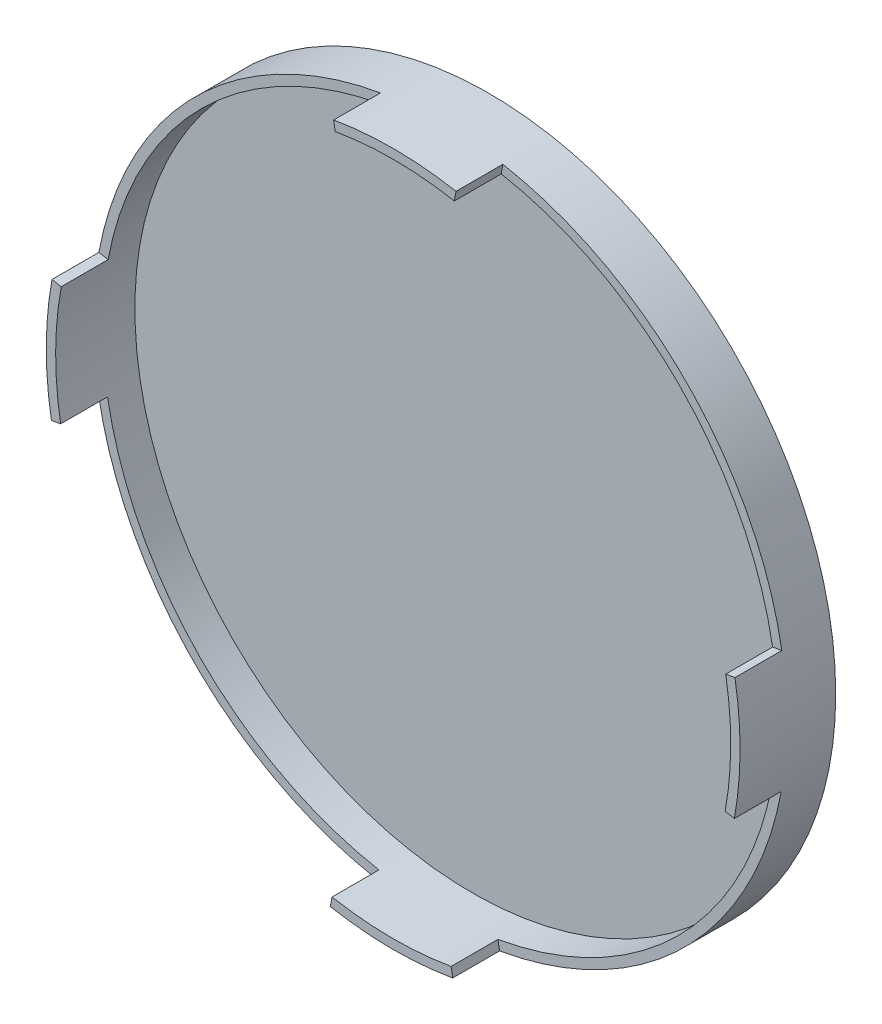
from build123d import *
from build123d.topology import SkipClean

# Parameters (mm, degrees)
SKETCH1_R           = 74
BOSS_EXTRUDE1_DEPTH = 3.5
SKETCH3_R           = 74
SKETCH3_R_2         = 72
BOSS_EXTRUDE2_DEPTH = 10.4
BOSS_EXTRUDE3_DEPTH = 10
CIRPATTERN1_COUNT   = 4
SKETCH2_R           = 16
SKETCH2_R_2         = 15
CUT_EXTRUDE1_DEPTH  = 1
SKETCH2_3_R         = 27
SKETCH2_3_R_2       = 26
CUT_EXTRUDE2_DEPTH  = 1
SKETCH2_4_R         = 38
SKETCH2_4_R_2       = 37
CUT_EXTRUDE3_DEPTH  = 1
SKETCH2_5_R         = 49
SKETCH2_5_R_2       = 48
CUT_EXTRUDE4_DEPTH  = 1
SKETCH2_6_R         = 60
SKETCH2_6_R_2       = 59
CUT_EXTRUDE5_DEPTH  = 1
FILLET1_R           = 0.5


with BuildPart() as part:
    # Sketch1 → Boss-Extrude1 (new body)
    with BuildSketch(Plane.XY):
        Circle(SKETCH1_R)
    extrude(amount=BOSS_EXTRUDE1_DEPTH)

    # Sketch3 → Boss-Extrude2 (add)
    with BuildSketch(Plane.XY):
        Circle(SKETCH3_R)
        Circle(SKETCH3_R_2, mode=Mode.SUBTRACT)
    extrude(amount=BOSS_EXTRUDE2_DEPTH)

    # Sketch5 → Boss-Extrude3 (add)
    with SkipClean():  # the faces are left unmerged after this step: merging them gives an invalid solid
        with BuildSketch(Plane.XY.offset(10.4)):
            with BuildLine():
                Line((-12.354120349, 70.932190932), (-12.697290359, 72.902529569))
                ThreePointArc((-12.697290359, 72.902529569), (0.361150189, 73.999118715), (13.408265197, 72.775122291))
                Line((13.408265197, 72.775122291), (13.045879651, 70.808227094))
                ThreePointArc((13.045879651, 70.808227094), (0.351389373, 71.999142533), (-12.354120349, 70.932190932))
            make_face()
        boss_extrude3 = extrude(amount=BOSS_EXTRUDE3_DEPTH)

    # CirPattern1: Boss-Extrude3 ×4 about axis
    with SkipClean():  # the faces are left unmerged after this step: merging them gives an invalid solid
        cirpattern1_axis = Axis((0, 0, 3.5), (0, 0, 1))
        for i in range(1, CIRPATTERN1_COUNT):
            add(boss_extrude3.rotate(cirpattern1_axis, i * 360 / CIRPATTERN1_COUNT))

    # Sketch2 → Cut-Extrude1 (cut)
    with SkipClean():  # the faces are left unmerged after this step: merging them gives an invalid solid
        with BuildSketch(Plane.XY):
            Circle(SKETCH2_R)
            Circle(SKETCH2_R_2, mode=Mode.SUBTRACT)
        extrude(amount=CUT_EXTRUDE1_DEPTH, mode=Mode.SUBTRACT)

    # Sketch2<3> → Cut-Extrude2 (cut)
    with SkipClean():  # the faces are left unmerged after this step: merging them gives an invalid solid
        with BuildSketch(Plane.XY):
            Circle(SKETCH2_3_R)
            Circle(SKETCH2_3_R_2, mode=Mode.SUBTRACT)
        extrude(amount=CUT_EXTRUDE2_DEPTH, mode=Mode.SUBTRACT)

    # Sketch2<4> → Cut-Extrude3 (cut)
    with SkipClean():  # the faces are left unmerged after this step: merging them gives an invalid solid
        with BuildSketch(Plane.XY):
            Circle(SKETCH2_4_R)
            Circle(SKETCH2_4_R_2, mode=Mode.SUBTRACT)
        extrude(amount=CUT_EXTRUDE3_DEPTH, mode=Mode.SUBTRACT)

    # Sketch2<5> → Cut-Extrude4 (cut)
    with SkipClean():  # the faces are left unmerged after this step: merging them gives an invalid solid
        with BuildSketch(Plane.XY):
            Circle(SKETCH2_5_R)
            Circle(SKETCH2_5_R_2, mode=Mode.SUBTRACT)
        extrude(amount=CUT_EXTRUDE4_DEPTH, mode=Mode.SUBTRACT)

    # Sketch2<6> → Cut-Extrude5 (cut)
    with SkipClean():  # the faces are left unmerged after this step: merging them gives an invalid solid
        with BuildSketch(Plane.XY):
            Circle(SKETCH2_6_R)
            Circle(SKETCH2_6_R_2, mode=Mode.SUBTRACT)
        extrude(amount=CUT_EXTRUDE5_DEPTH, mode=Mode.SUBTRACT)

    # Fillet1
    fillet1_edges = [part.edges().sort_by_distance(p)[0] for p in [
        (-15, 0, 0),
        (-16, 0, 1),
        (-26, 0, 0),
        (-27, 0, 0),
        (-37, 0, 0),
        (-38, 0, 0),
        (-48, 0, 0),
        (-49, 0, 0),
        (-59, 0, 0),
        (-60, 0, 0),
    ]]
    fillet(fillet1_edges, radius=FILLET1_R)


solid = part.part
